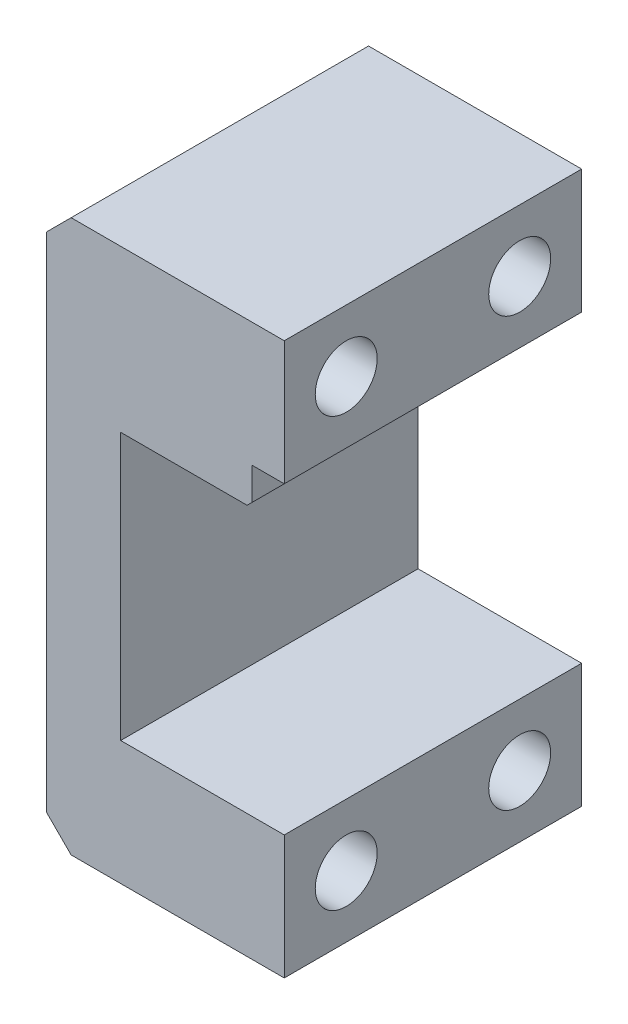
from build123d import *

# Parameters (mm, degrees)
EXTRUDE_1_DEPTH    = 12
CHAMFER_1_SIZE     = 0.2
HOLE_WIZARD_M3_2_D = 2.5
CHAMFER_2_SIZE     = 1


with BuildPart() as part:
    # 草图1 → 凸台-拉伸1 (new body)
    with BuildSketch(Plane.XY):
        Polygon((0, 0), (0, 22.27), (9.6, 22.27), (9.6, 17.27), (8.3, 17.27), (8.3, 15.77), (3, 15.77), (3, 5), (9.6, 5), (9.6, 0), align=None)
    extrude(amount=EXTRUDE_1_DEPTH)

    # 倒角1
    chamfer_1_edges = [part.edges().sort_by_distance(p)[0] for p in [
        (8.3, 15.77, 6),
    ]]
    chamfer(chamfer_1_edges, length=CHAMFER_1_SIZE)

    # M3 螺纹孔2 (through all)
    with Locations(Plane(origin=(0, 2.5, 2.5), x_dir=(0, 0, -1), z_dir=(-1, 0, 0))):
        with Locations((0, 0), (-7, 0), (-7, -17.27), (0, -17.27)):
            Hole(HOLE_WIZARD_M3_2_D / 2)

    # 倒角2
    chamfer_2_edges = [part.edges().sort_by_distance(p)[0] for p in [
        (0, 0, 6),
        (0, 22.27, 6),
    ]]
    chamfer(chamfer_2_edges, length=CHAMFER_2_SIZE)


solid = part.part
